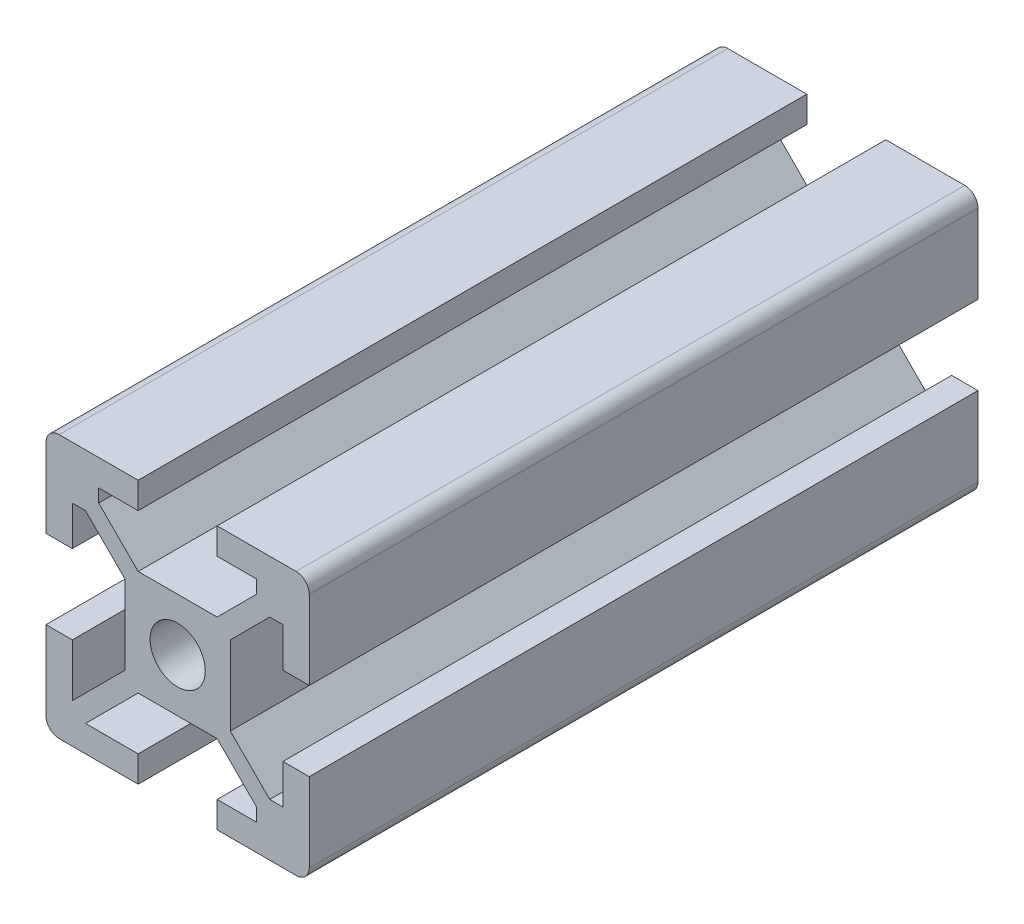
from build123d import *

# Parameters (mm, degrees)
SKETCH1_W           = 1
SKETCH1_H           = 1
SKETCH1_W_2         = 6
SKETCH1_H_2         = 6
SKETCH1_R           = 2.1
BOSS_EXTRUDE1_DEPTH = 50.8
FILLET1_R           = 1


with BuildPart() as part:
    # Sketch1 → Boss-Extrude1 (new body)
    # profile 1 of 35: a face of its own
    with BuildSketch(Plane.XY):
        Polygon((-6, 7), (-6, 8), (-7, 8), align=None)
    # profile 2 of 35: a face of its own
    with BuildSketch(Plane.XY):
        Polygon((-6, 7), (-7, 8), (-8, 8), (-8, 7), (-7, 6), (-6, 6), align=None)
    # profile 3 of 35: a face of its own
    with BuildSketch(Plane.XY):
        Polygon((-8, 7), (-8, 6), (-7, 6), align=None)
    # profile 4 of 35: a face of its own
    with BuildSketch(Plane.XY):
        Polygon((-3, 8), (-3, 10), (-10, 10), (-10, 3), (-8, 3), (-8, 6), (-8, 7), (-8, 8), (-7, 8), (-6, 8), align=None)
    # profile 5 of 35: a face of its own
    with BuildSketch(Plane.XY):
        Polygon((-6, 5), (-6, 6), (-7, 6), align=None)
    # profile 6 of 35: a face of its own
    with BuildSketch(Plane.XY):
        Polygon((-6, 6), (-5, 6), (-6, 7), align=None)
    # profile 7 of 35: a face of its own
    with BuildSketch(Plane.XY):
        Polygon((-3, 4), (-5, 6), (-6, 6), (-6, 5), (-4, 3), (-4, 4), align=None)
    # profile 8 of 35: a face of its own
    with BuildSketch(Plane.XY):
        with Locations((-3.5, 3.5)):
            Rectangle(SKETCH1_W, SKETCH1_H)
    # profile 9 of 35: a face of its own
    with BuildSketch(Plane.XY):
        with Locations((0, 3.5)):
            Rectangle(SKETCH1_W_2, SKETCH1_H)
    # profile 10 of 35: a face of its own
    with BuildSketch(Plane.XY):
        with Locations((-3.5, 0)):
            Rectangle(SKETCH1_W, SKETCH1_H_2)
    # profile 11 of 35: a face of its own
    with BuildSketch(Plane.XY):
        Rectangle(SKETCH1_W_2, SKETCH1_H_2)
        Circle(SKETCH1_R, mode=Mode.SUBTRACT)
    # profile 12 of 35: a face of its own
    with BuildSketch(Plane.XY):
        with Locations((3.5, 3.5)):
            Rectangle(SKETCH1_W, SKETCH1_H)
    # profile 13 of 35: a face of its own
    with BuildSketch(Plane.XY):
        Polygon((6, 6), (5, 6), (3, 4), (4, 4), (4, 3), (6, 5), align=None)
    # profile 14 of 35: a face of its own
    with BuildSketch(Plane.XY):
        Polygon((6, 7), (5, 6), (6, 6), align=None)
    # profile 15 of 35: a face of its own
    with BuildSketch(Plane.XY):
        Polygon((6, 6), (6, 5), (7, 6), align=None)
    # profile 16 of 35: a face of its own
    with BuildSketch(Plane.XY):
        Polygon((8, 8), (7, 8), (6, 7), (6, 6), (7, 6), (8, 7), align=None)
    # profile 17 of 35: a face of its own
    with BuildSketch(Plane.XY):
        Polygon((7, 8), (6, 8), (6, 7), align=None)
    # profile 18 of 35: a face of its own
    with BuildSketch(Plane.XY):
        Polygon((7, 6), (8, 6), (8, 7), align=None)
    # profile 19 of 35: a face of its own
    with BuildSketch(Plane.XY):
        Polygon((10, 3), (10, 10), (3, 10), (3, 8), (6, 8), (7, 8), (8, 8), (8, 7), (8, 6), (8, 3), align=None)
    # profile 20 of 35: a face of its own
    with BuildSketch(Plane.XY):
        with Locations((3.5, 0)):
            Rectangle(SKETCH1_W, SKETCH1_H_2)
    # profile 21 of 35: a face of its own
    with BuildSketch(Plane.XY):
        with Locations((3.5, -3.5)):
            Rectangle(SKETCH1_W, SKETCH1_H)
    # profile 22 of 35: a face of its own
    with BuildSketch(Plane.XY):
        Polygon((6, -6), (6, -5), (4, -3), (4, -4), (3, -4), (5, -6), align=None)
    # profile 23 of 35: a face of its own
    with BuildSketch(Plane.XY):
        Polygon((7, -6), (6, -5), (6, -6), align=None)
    # profile 24 of 35: a face of its own
    with BuildSketch(Plane.XY):
        Polygon((6, -7), (6, -6), (5, -6), align=None)
    # profile 25 of 35: a face of its own
    with BuildSketch(Plane.XY):
        Polygon((8, -8), (8, -7), (7, -6), (6, -6), (6, -7), (7, -8), align=None)
    # profile 26 of 35: a face of its own
    with BuildSketch(Plane.XY):
        Polygon((6, -7), (6, -8), (7, -8), align=None)
    # profile 27 of 35: a face of its own
    with BuildSketch(Plane.XY):
        Polygon((8, -7), (8, -6), (7, -6), align=None)
    # profile 28 of 35: a face of its own
    with BuildSketch(Plane.XY):
        Polygon((10, -10), (10, -3), (8, -3), (8, -6), (8, -7), (8, -8), (7, -8), (6, -8), (3, -8), (3, -10), align=None)
    # profile 29 of 35: a face of its own
    with BuildSketch(Plane.XY):
        with Locations((0, -3.5)):
            Rectangle(SKETCH1_W_2, SKETCH1_H)
    # profile 30 of 35: a face of its own
    with BuildSketch(Plane.XY):
        with Locations((-3.5, -3.5)):
            Rectangle(SKETCH1_W, SKETCH1_H)
    # profile 31 of 35: a face of its own
    with BuildSketch(Plane.XY):
        Polygon((-4, -3), (-6, -5), (-6, -6), (-5, -6), (-3, -4), (-4, -4), align=None)
    # profile 32 of 35: a face of its own
    with BuildSketch(Plane.XY):
        Polygon((-6, -7), (-5, -6), (-6, -6), align=None)
    # profile 33 of 35: a face of its own
    with BuildSketch(Plane.XY):
        Polygon((-6, -6), (-6, -5), (-7, -6), align=None)
    # profile 34 of 35: a face of its own
    with BuildSketch(Plane.XY):
        Polygon((-7, -6), (-8, -7), (-8, -8), (-7, -8), (-6, -7), (-6, -6), align=None)
    # profile 35 of 35: a face of its own
    with BuildSketch(Plane.XY):
        Polygon((-8, -3), (-10, -3), (-10, -10), (-3, -10), (-3, -8), (-6, -8), (-7, -8), (-8, -8), (-8, -7), (-8, -6), align=None)
    extrude(amount=BOSS_EXTRUDE1_DEPTH)

    # Fillet1
    fillet1_edges = [part.edges().sort_by_distance(p)[0] for p in [
        (-10, -10, 25.4),
        (-10, 10, 25.4),
        (10, 10, 25.4),
        (10, -10, 25.4),
    ]]
    fillet(fillet1_edges, radius=FILLET1_R)


solid = part.part
